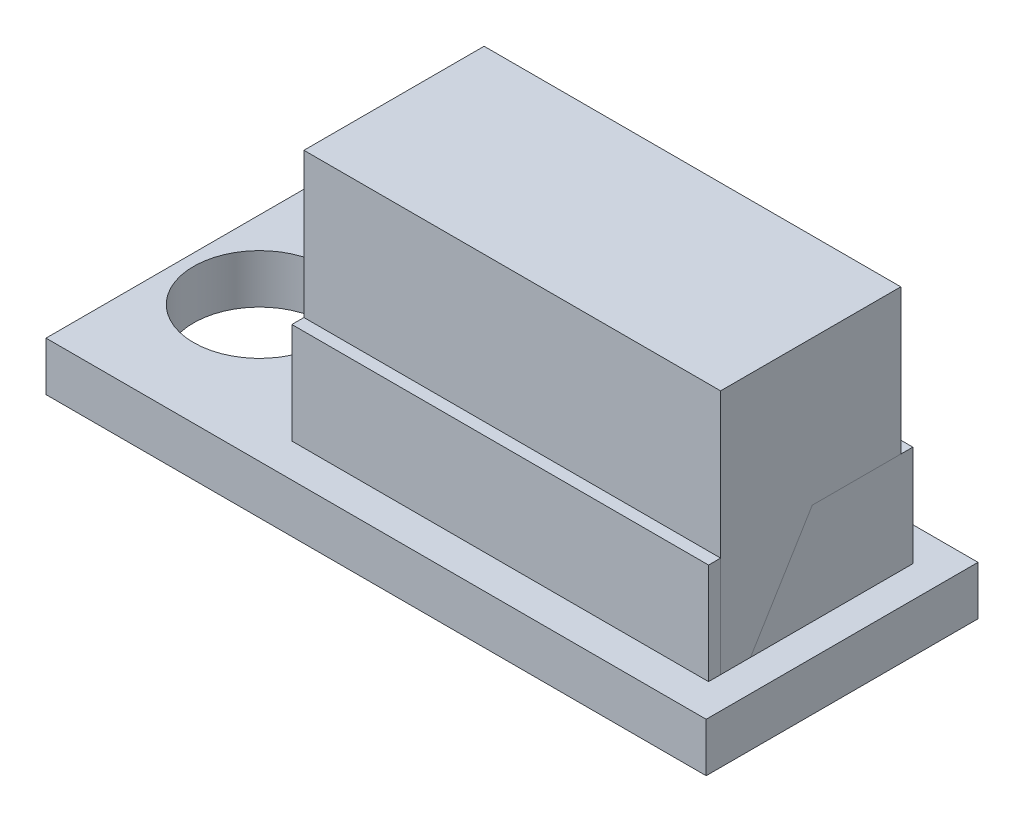
from build123d import *

# Parameters (mm, degrees)
SKETCH1_W           = 21.59
SKETCH1_H           = 8.89
SKETCH1_R           = 2.159
BOSS_EXTRUDE1_DEPTH = 1.6002
SKETCH2_W           = 13.6271
SKETCH2_H           = 6.6802
BOSS_EXTRUDE2_DEPTH = 4.9022
SKETCH3_W           = 13.6271
SKETCH3_H           = 5.8928
BOSS_EXTRUDE3_DEPTH = 9.6393


with BuildPart() as part:
    # Sketch1 → Boss-Extrude1 (new body)
    with BuildSketch(Plane(origin=(0, 0, 0), x_dir=(1, 0, 0), z_dir=(0, 1, 0))):
        with Locations((-40.899991391, -20.536497471)):
            Rectangle(SKETCH1_W, SKETCH1_H)
        with Locations(Location((-49.154991391, -20.536497471, 0), (0, 0, 270))):
            Circle(SKETCH1_R, mode=Mode.SUBTRACT)
    extrude(amount=BOSS_EXTRUDE1_DEPTH)

    # Sketch2 → Boss-Extrude2 (add)
    with BuildSketch(Plane(origin=(0, 0, 0), x_dir=(1, 0, 0), z_dir=(0, 1, 0))):
        with Locations((-37.945014507, -20.536497471)):
            Rectangle(SKETCH2_W, SKETCH2_H)
    extrude(amount=BOSS_EXTRUDE2_DEPTH)


with BuildPart() as body_2:
    # Sketch3 → Boss-Extrude3 (new body)
    with BuildSketch(Plane(origin=(0, 0, 0), x_dir=(1, 0, 0), z_dir=(0, 1, 0))):
        with Locations((-37.945014507, -20.536497471)):
            Rectangle(SKETCH3_W, SKETCH3_H)
    extrude(amount=BOSS_EXTRUDE3_DEPTH)


solid = Compound([part.part, body_2.part])
